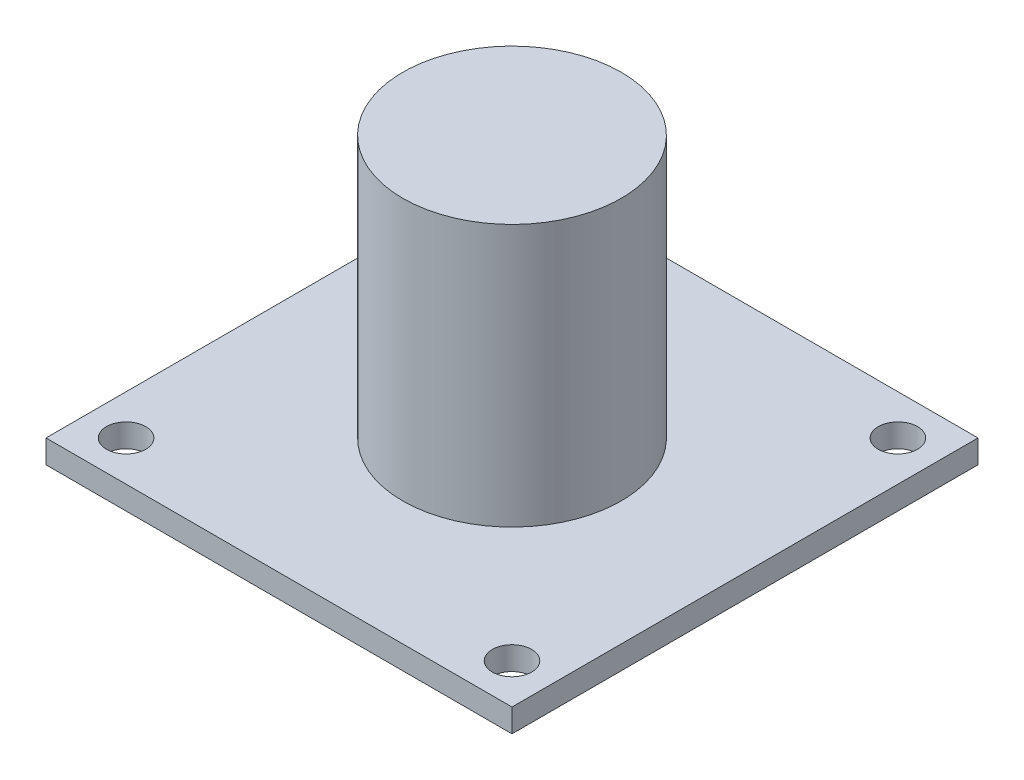
from build123d import *

# Parameters (mm, degrees)
SKETCH_1_W      = 32
SKETCH_1_H      = 32
SKETCH_1_R      = 1.35
EXTRUDE_1_DEPTH = 1.6
SKETCH_2_R      = 7.5
EXTRUDE_2_DEPTH = 18


with BuildPart() as part:
    # 草图1 → 凸台-拉伸1 (new body)
    with BuildSketch(Plane(origin=(0, 0, 0), x_dir=(1, 0, 0), z_dir=(0, 1, 0))):
        Rectangle(SKETCH_1_W, SKETCH_1_H)
        with Locations(Location((-13.25, 13.25, 0), (0, 0, 270))):
            Circle(SKETCH_1_R, mode=Mode.SUBTRACT)
        with Locations(Location((13.25, 13.25, 0), (0, 0, 270))):
            Circle(SKETCH_1_R, mode=Mode.SUBTRACT)
        with Locations(Location((-13.25, -13.25, 0), (0, 0, 270))):
            Circle(SKETCH_1_R, mode=Mode.SUBTRACT)
        with Locations(Location((13.25, -13.25, 0), (0, 0, 270))):
            Circle(SKETCH_1_R, mode=Mode.SUBTRACT)
    extrude(amount=EXTRUDE_1_DEPTH)

    # 草图2 → 凸台-拉伸2 (add)
    with BuildSketch(Plane(origin=(0, 1.6, 0), x_dir=(1, 0, 0), z_dir=(0, 1, 0))):
        with Locations(Location((0, 0, 0), (0, 0, 270))):
            Circle(SKETCH_2_R)
    extrude(amount=EXTRUDE_2_DEPTH)


solid = part.part
